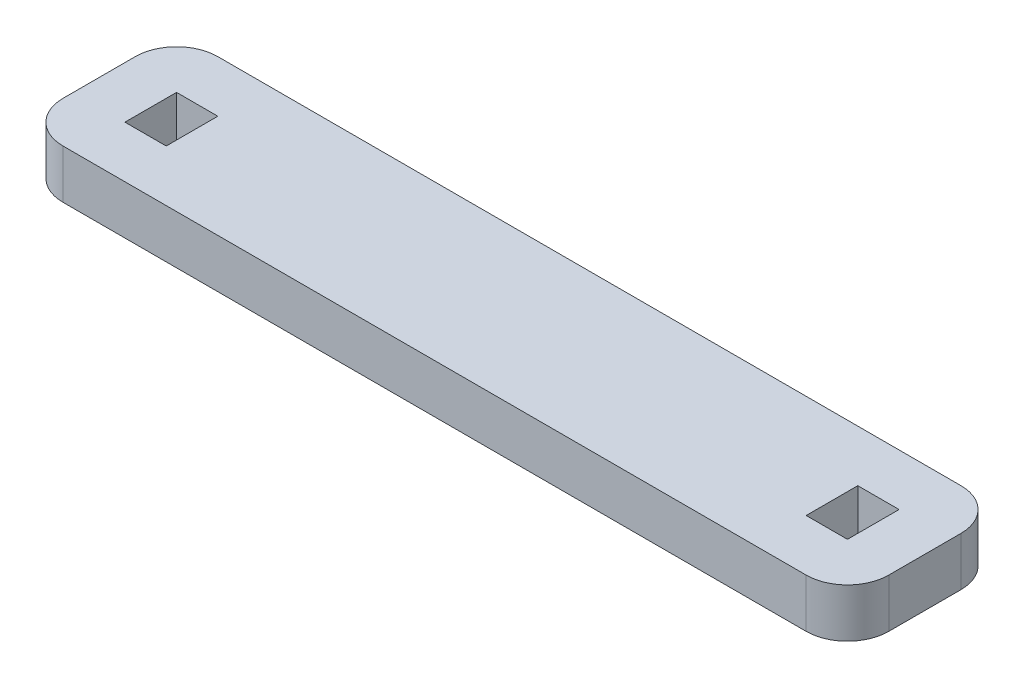
from build123d import *

# Parameters (mm, degrees)
SKETCH1_W           = 50.8
SKETCH1_H           = 9.525
SKETCH1_W_2         = 2.54
SKETCH1_H_2         = 3.175
BOSS_EXTRUDE1_DEPTH = 1.5
FILLET1_R           = 2.54


with BuildPart() as part:
    # Sketch1 → Boss-Extrude1 (new, symmetric)
    with BuildSketch(Plane(origin=(0, 0, 0), x_dir=(1, 0, 0), z_dir=(0, 1, 0))):
        Rectangle(SKETCH1_W, SKETCH1_H)
        with Locations((-20.955, 0)):
            Rectangle(SKETCH1_W_2, SKETCH1_H_2, mode=Mode.SUBTRACT)
        with Locations((20.955, 0)):
            Rectangle(SKETCH1_W_2, SKETCH1_H_2, mode=Mode.SUBTRACT)
    extrude(amount=BOSS_EXTRUDE1_DEPTH, both=True)

    # Fillet1
    fillet1_edges = [part.edges().sort_by_distance(p)[0] for p in [
        (-25.4, 0, -4.7625),
        (25.4, 0, -4.7625),
        (25.4, 0, 4.7625),
        (-25.4, 0, 4.7625),
    ]]
    fillet(fillet1_edges, radius=FILLET1_R)


solid = part.part
